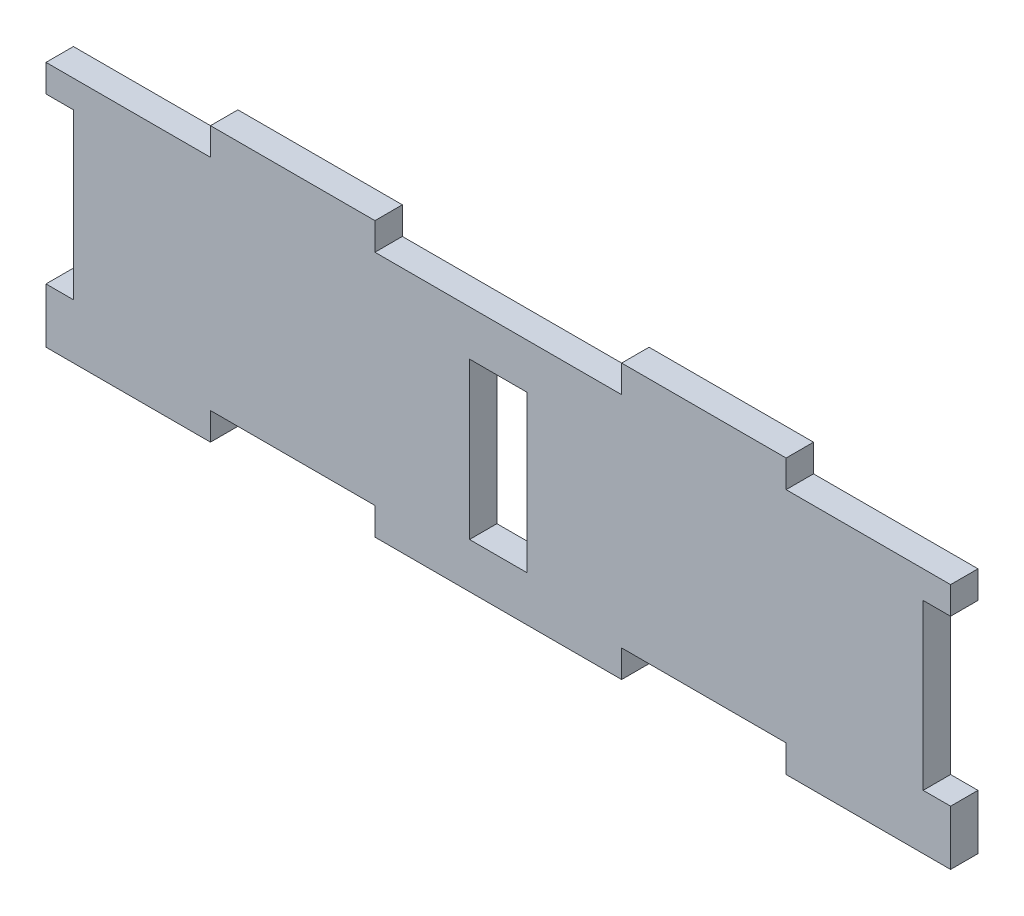
from build123d import *

# Parameters (mm, degrees)
SKETCH2_W           = 10.5
SKETCH2_H           = 28.5
BOSS_EXTRUDE2_DEPTH = 5


with BuildPart() as part:
    # Sketch2 → Boss-Extrude2 (new body)
    with BuildSketch(Plane.XY):
        Polygon((144.256991051, 80.778497144), (144.256991051, 85.778497144), (114.256991051, 85.778497144), (114.256991051, 90.778497144), (84.256991051, 90.778497144), (84.256991051, 85.778497144), (39.256991051, 85.778497144), (39.256991051, 90.778497144), (9.256991051, 90.778497144), (9.256991051, 85.778497144), (-20.743008949, 85.778497144), (-20.743008949, 80.778497144), (-15.743008949, 80.778497144), (-15.743008949, 50.778497144), (-20.743008949, 50.778497144), (-20.743008949, 40.778497144), (9.256991051, 40.778497144), (9.256991051, 45.778497144), (39.256991051, 45.778497144), (39.256991051, 40.778497144), (84.256991051, 40.778497144), (84.256991051, 45.778497144), (114.256991051, 45.778497144), (114.256991051, 40.778497144), (144.256991051, 40.778497144), (144.256991051, 50.778497144), (139.256991051, 50.778497144), (139.256991051, 80.778497144), align=None)
        with Locations((61.756991051, 63.278497144)):
            Rectangle(SKETCH2_W, SKETCH2_H, mode=Mode.SUBTRACT)
    extrude(amount=BOSS_EXTRUDE2_DEPTH)


solid = part.part
